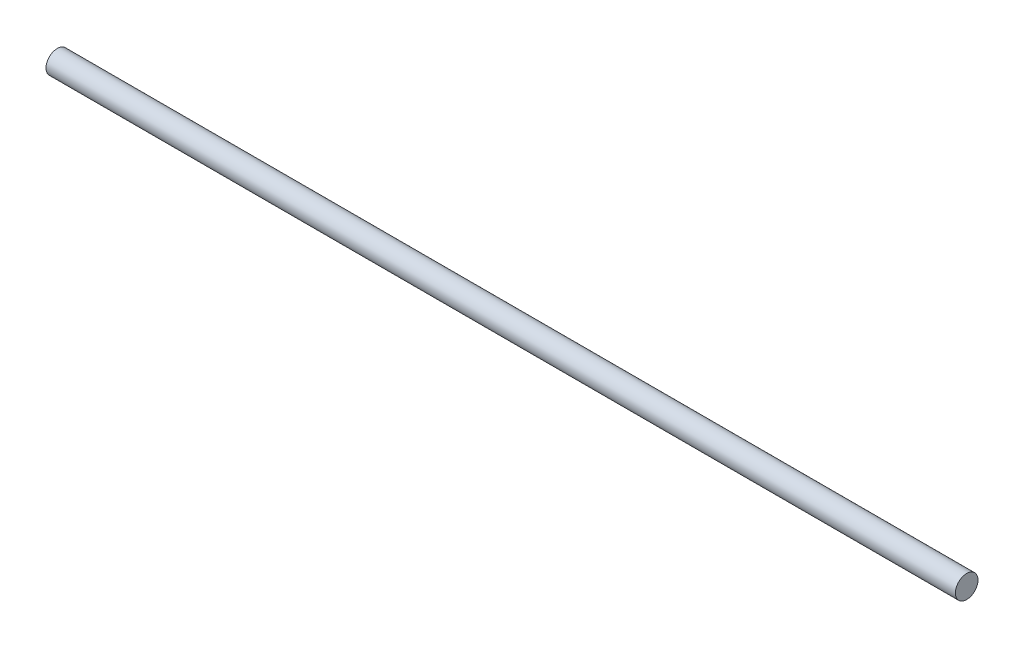
from build123d import *

# Parameters (mm, degrees)
SKETCH1_R           = 4.445
BOSS_EXTRUDE1_DEPTH = 357.378


with BuildPart() as part:
    # Sketch1 → Boss-Extrude1 (new body)
    with BuildSketch(Plane(origin=(0, 0, 0), x_dir=(0, 0, -1), z_dir=(1, 0, 0))):
        Circle(SKETCH1_R)
    extrude(amount=BOSS_EXTRUDE1_DEPTH)


solid = part.part
